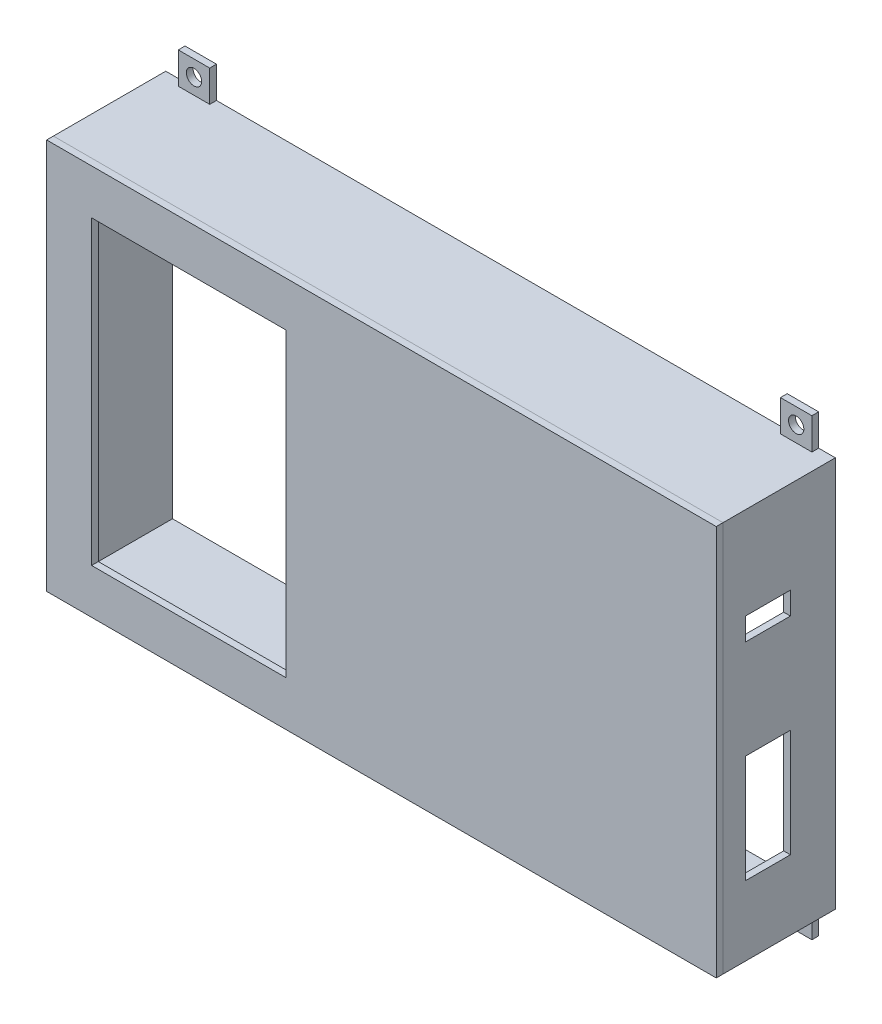
from build123d import *

# Parameters (mm, degrees)
SKETCH1_W                     = 149
SKETCH1_H                     = 87
SKETCH1_W_2                   = 146
SKETCH1_H_2                   = 84
BOSS_EXTRUDE1_DEPTH           = 25
SKETCH2_W                     = 149
SKETCH2_H                     = 87
SKETCH2_W_2                   = 43.2875
SKETCH2_H_2                   = 67
BOSS_EXTRUDE2_DEPTH           = 1.5
SKETCH3_W                     = 7
SKETCH3_H                     = 7
BOSS_EXTRUDE3_DEPTH           = 1.5
SKETCH5_W                     = 1.7
SKETCH5_H                     = 1.5
M3_CLEARANCE_HOLE1_AT_2_COUNT = 2
M3_CLEARANCE_HOLE1_AT_2_PITCH = 94
M3_CLEARANCE_HOLE1_AT_3_COUNT = 2
M3_CLEARANCE_HOLE1_AT_3_PITCH = 134
M3_CLEARANCE_HOLE1_AT_4_COUNT = 2
M3_CLEARANCE_HOLE1_AT_4_PITCH = 163.682619725
SKETCH9_W                     = 10
SKETCH9_H                     = 24
SKETCH9_H_2                   = 5
CUT_EXTRUDE1_DEPTH            = 1.5


with BuildPart() as part:
    # Sketch1 → Boss-Extrude1 (new body)
    with BuildSketch(Plane.XY):
        with Locations((77.5, 53.618750014)):
            Rectangle(SKETCH1_W, SKETCH1_H)
        with Locations((77.5, 53.618750014)):
            Rectangle(SKETCH1_W_2, SKETCH1_H_2, mode=Mode.SUBTRACT)
    extrude(amount=BOSS_EXTRUDE1_DEPTH)

    # Sketch3 → Boss-Extrude3 (add)
    with BuildSketch(Plane.XY):
        with Locations((10.7875, 100.618750014)):
            Rectangle(SKETCH3_W, SKETCH3_H)
        with Locations((10.7875, 6.618750014)):
            Rectangle(SKETCH3_W, SKETCH3_H)
        with Locations((144.7875, 6.618750014)):
            Rectangle(SKETCH3_W, SKETCH3_H)
        with Locations((144.7875, 100.618750014)):
            Rectangle(SKETCH3_W, SKETCH3_H)
    extrude(amount=BOSS_EXTRUDE3_DEPTH)

    # Sketch5 → M3 Clearance Hole1 (revolve, cut)
    with BuildSketch(Plane(origin=(10.7875, 6.618750014, 1.5), x_dir=(0, -1, 0), z_dir=(1, 0, 0))):
        with Locations((0.85, 0.75)):
            Rectangle(SKETCH5_W, SKETCH5_H)
    m3_clearance_hole1 = revolve(axis=Axis((10.7875, 6.618750014, 7.85), (0, 0, -1)), mode=Mode.SUBTRACT)

    # M3 Clearance Hole1 at 2: M3 Clearance Hole1 ×2
    with Locations(*[(0, i * M3_CLEARANCE_HOLE1_AT_2_PITCH, 0) for i in range(1, M3_CLEARANCE_HOLE1_AT_2_COUNT)]):
        add(m3_clearance_hole1, mode=Mode.SUBTRACT)

    # M3 Clearance Hole1 at 3: M3 Clearance Hole1 ×2
    with Locations(*[(i * M3_CLEARANCE_HOLE1_AT_3_PITCH, 0, 0) for i in range(1, M3_CLEARANCE_HOLE1_AT_3_COUNT)]):
        add(m3_clearance_hole1, mode=Mode.SUBTRACT)

    # M3 Clearance Hole1 at 4: M3 Clearance Hole1 ×2
    with Locations(*[Vector(0.8186574739897755, 0.5742821086196923, 0) * (i * M3_CLEARANCE_HOLE1_AT_4_PITCH) for i in range(1, M3_CLEARANCE_HOLE1_AT_4_COUNT)]):
        add(m3_clearance_hole1, mode=Mode.SUBTRACT)

    # Sketch9 → Cut-Extrude1 (cut)
    with BuildSketch(Plane(origin=(152, 0, 0), x_dir=(0, 0, -1), z_dir=(1, 0, 0))):
        with Locations((-15, 37.618750014)):
            Rectangle(SKETCH9_W, SKETCH9_H)
        with Locations((-15, 74.118750014)):
            Rectangle(SKETCH9_W, SKETCH9_H_2)
    extrude(amount=-CUT_EXTRUDE1_DEPTH, mode=Mode.SUBTRACT)


with BuildPart() as body_2:
    # Sketch2 → Boss-Extrude2 (new body)
    with BuildSketch(Plane.XY.offset(25)):
        with Locations((77.5, 53.618750014)):
            Rectangle(SKETCH2_W, SKETCH2_H)
        with Locations((34.64375, 53.618750014)):
            Rectangle(SKETCH2_W_2, SKETCH2_H_2, mode=Mode.SUBTRACT)
    extrude(amount=BOSS_EXTRUDE2_DEPTH)


solid = Compound([part.part, body_2.part])
